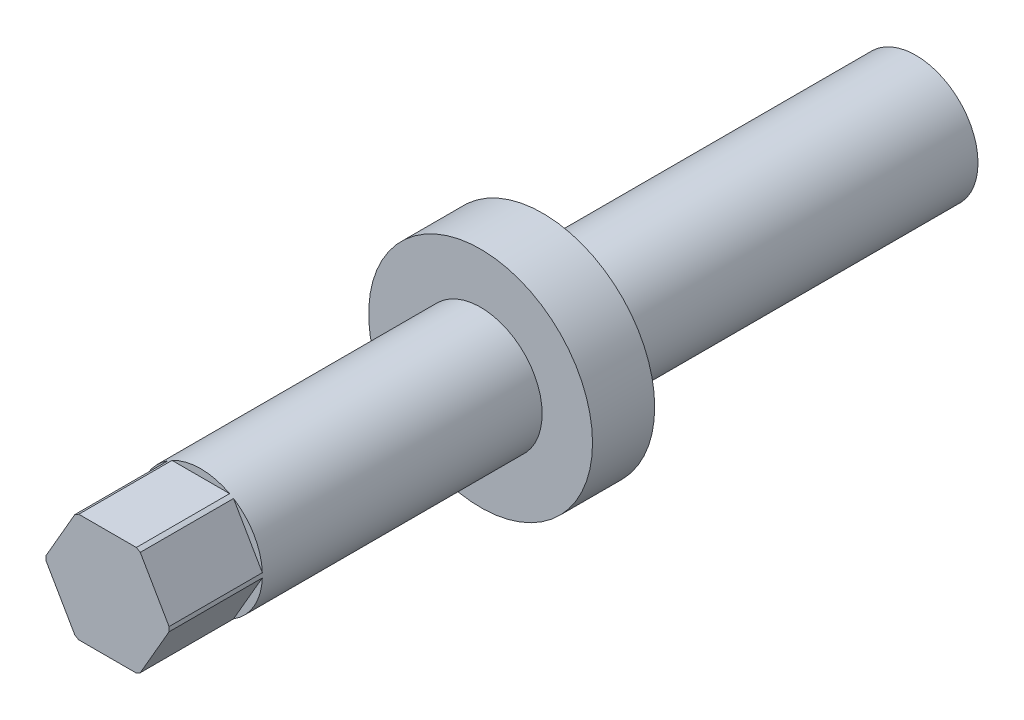
from build123d import *

# Parameters (mm, degrees)
F_1_4_20_TAPPED_HOLE1_D     = 5.1054
F_1_4_20_TAPPED_HOLE1_DEPTH = 16.51
F_1_4_20_TAPPED_HOLE1_TIP   = 1.533816902
CUT_EXTRUDE1_DEPTH          = 9.525


with BuildPart() as part:
    # Sketch1 → Revolve2 (revolve)
    with BuildSketch(Plane(origin=(0, 0, 0), x_dir=(0, 0, -1), z_dir=(1, 0, 0)), mode=Mode.PRIVATE) as revolve2_sk:
        Polygon((38.1, 6.2865), (0, 6.2865), (0, 0), (82.55, 0), (82.55, 6.35), (44.45, 6.35), (44.45, 11.43), (38.1, 11.43), align=None)
    revolve(revolve2_sk.sketch.rotate(Axis((0, 0, 0), (0, 0, -1)), 90), axis=Axis((0, 0, 0), (0, 0, -1)))

    # 1/4-20 Tapped Hole1
    with Locations(Plane(origin=(0, 0, -82.55), x_dir=(-1, 0, 0), z_dir=(0, 0, -1))):
        with Locations((0, 0)):
            Hole(F_1_4_20_TAPPED_HOLE1_D / 2, depth=F_1_4_20_TAPPED_HOLE1_DEPTH)
            with Locations((0, 0, -(F_1_4_20_TAPPED_HOLE1_DEPTH + F_1_4_20_TAPPED_HOLE1_TIP / 2))):  # 118° drill point
                Cone(0, F_1_4_20_TAPPED_HOLE1_D / 2, F_1_4_20_TAPPED_HOLE1_TIP, mode=Mode.SUBTRACT)

    # Sketch4 → Cut-Extrude1 (cut)
    with BuildSketch(Plane.XY):
        with BuildLine():
            ThreePointArc((2.9407768, 5.55625), (0, 6.2865), (-2.9407768, 5.55625))
            Line((-2.9407768, 5.55625), (2.9407768, 5.55625))
        make_face()
        with BuildLine():
            ThreePointArc((6.28224205, 0.231337584), (5.444268701, 3.14325), (3.34146525, 5.324912416))
            Line((3.34146525, 5.324912416), (6.28224205, 0.231337584))
        make_face()
        with BuildLine():
            Line((6.28224205, -0.231337584), (3.34146525, -5.324912416))
            ThreePointArc((3.34146525, -5.324912416), (5.444268701, -3.14325), (6.28224205, -0.231337584))
        make_face()
        with BuildLine():
            Line((2.9407768, -5.55625), (-2.9407768, -5.55625))
            ThreePointArc((-2.9407768, -5.55625), (0, -6.2865), (2.9407768, -5.55625))
        make_face()
        with BuildLine():
            Line((-3.34146525, -5.324912416), (-6.28224205, -0.231337584))
            ThreePointArc((-6.28224205, -0.231337584), (-5.444268701, -3.14325), (-3.34146525, -5.324912416))
        make_face()
        with BuildLine():
            ThreePointArc((-3.34146525, 5.324912416), (-5.444268701, 3.14325), (-6.28224205, 0.231337584))
            Line((-6.28224205, 0.231337584), (-3.34146525, 5.324912416))
        make_face()
    extrude(amount=-CUT_EXTRUDE1_DEPTH, mode=Mode.SUBTRACT)


solid = part.part
